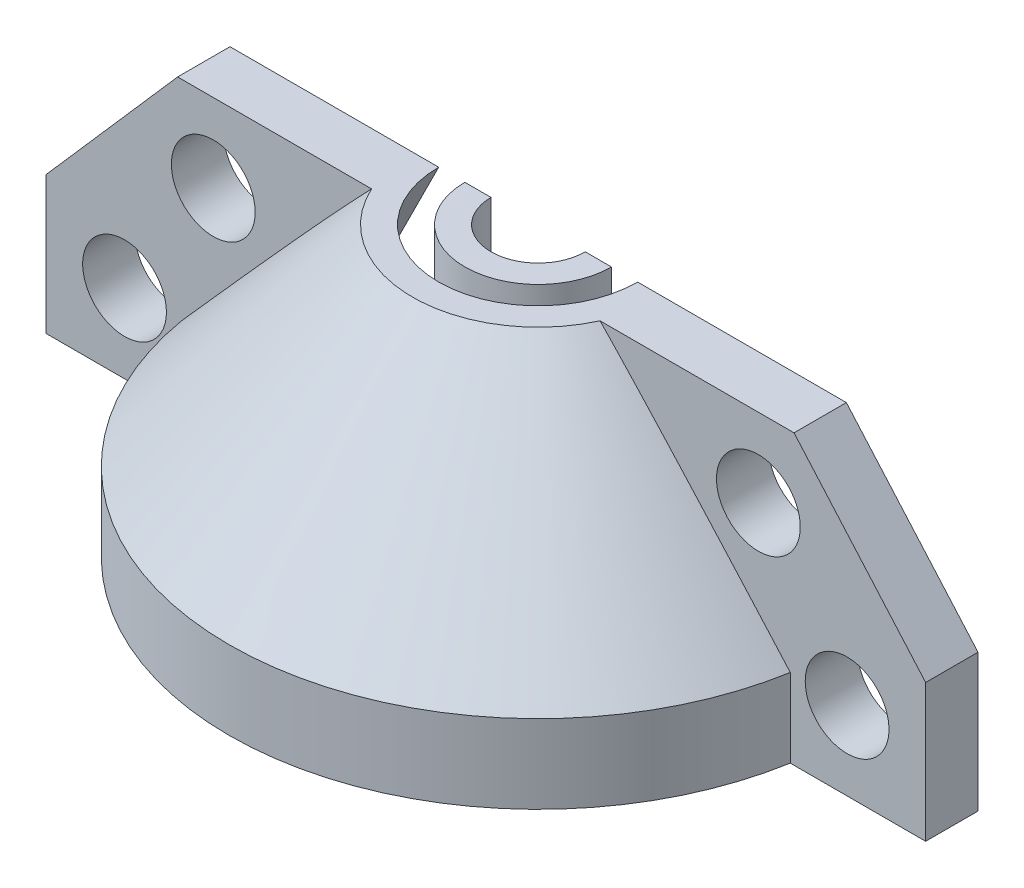
from build123d import *

# Parameters (mm, degrees)
SKETCH1_W             = 1
SKETCH1_H             = 8
REVOLVE1_ANGLE        = 180
SKETCH2_R             = 1.6
BOSS_EXTRUDE1_DEPTH   = 2
BOSS_EXTRUDE1_2_DEPTH = 2
REVOLVE2_ANGLE        = 180


with BuildPart() as part:
    # Sketch1 → Revolve1 (revolve)
    with BuildSketch(Plane.XY):
        Polygon((-1.8, -3), (-1.8, 0), (-2.8, 0), (-7.8, 0), (-10.8, 0), (-10.8, -3), align=None)
        Polygon((-10.8, 0), (-3.8, 8), (-7.8, 0), align=None)
        with Locations((-2.3, 4)):
            Rectangle(SKETCH1_W, SKETCH1_H)
    revolve(axis=Axis((0, 0, 0), (0, 1, 0)), revolution_arc=REVOLVE1_ANGLE)



with BuildPart() as body_2:
    # Sketch2 → Boss-Extrude1 (new body)
    with BuildSketch(Plane(origin=(0, 0, 0), x_dir=(-1, 0, 0), z_dir=(0, 0, -1))):
        Polygon((-10.8, -3), (-16.8, -3), (-16.8, 2.254410697), (-11.77260936, 8), (-3.8, 8), (-10.8, 0), align=None)
        with Locations((-10.41130468, 5)):
            Circle(SKETCH2_R, mode=Mode.SUBTRACT)
        with Locations((-13.8, 0)):
            Circle(SKETCH2_R, mode=Mode.SUBTRACT)
    extrude(amount=-BOSS_EXTRUDE1_DEPTH)


with BuildPart() as body_3:
    # Sketch2 → Boss-Extrude1 2 (new body)
    with BuildSketch(Plane(origin=(0, 0, 0), x_dir=(-1, 0, 0), z_dir=(0, 0, -1))):
        Polygon((10.8, 0), (3.8, 8), (11.77260936, 8), (16.8, 2.254410697), (16.8, -3), (10.8, -3), align=None)
        with Locations(Location((13.8, 0, 0), (0, 0, 180))):
            Circle(SKETCH2_R, mode=Mode.SUBTRACT)
        with Locations(Location((10.41130468, 5, 0), (0, 0, 180))):
            Circle(SKETCH2_R, mode=Mode.SUBTRACT)
    extrude(amount=-BOSS_EXTRUDE1_2_DEPTH)


with BuildPart() as part_1:
    add(part.part)

    add(body_2.part)  # Revolve2 merges body 2

    add(body_3.part)  # Revolve2 merges body 3
    # Sketch3 → Revolve2 (revolve)
    with BuildSketch(Plane(origin=(0, 0, 0), x_dir=(-1, 0, 0), z_dir=(0, 0, -1))):
        Polygon((-11.8, -3), (-11.8, 0), (-4.8, 8), (-3.8, 8), (-10.8, 0), (-10.8, -3), align=None)
    revolve(axis=Axis((0, 0, 0), (0, -1, 0)), revolution_arc=REVOLVE2_ANGLE)


solid = part_1.part
